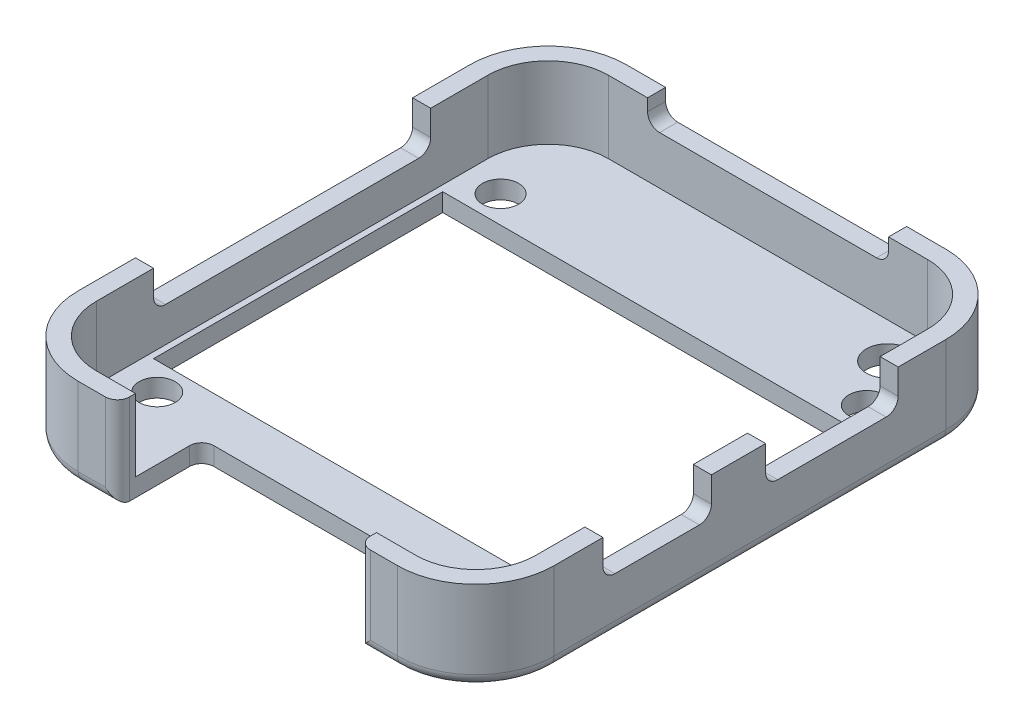
from build123d import *

# Parameters (mm, degrees)
EXTRUDE_1_DEPTH      = 1.5
EXTRUDE_2_DEPTH      = 6
EXTRUDE_2_DEPTH_BACK = 1.5
CUT_EXTRUDE_1_REACH  = 52.165
SKETCH_4_W           = 20
SKETCH_4_H           = 19.175354044
CUT_EXTRUDE_2_DEPTH  = 7
FILLET_1_R           = 1
SKETCH_5_W           = 35.5
SKETCH_5_H           = 24
CUT_EXTRUDE_3_DEPTH  = 7
SKETCH_6_R           = 1.5
CUT_EXTRUDE_4_DEPTH  = 7
CUT_EXTRUDE_5_DEPTH  = 7
CUT_EXTRUDE_6_DEPTH  = 7
SKETCH_9_R           = 1.75
CUT_EXTRUDE_7_DEPTH  = 10


with BuildPart() as part:
    # 草图1 → 凸台-拉伸1 (new body)
    with BuildSketch(Plane(origin=(0, 0, 0), x_dir=(1, 0, 0), z_dir=(0, 1, 0))):
        with BuildLine():
            Line((-13.25, 21.25), (13.25, 21.25))
            ThreePointArc((13.25, 21.25), (16.785533906, 19.785533906), (18.25, 16.25))
            Line((18.25, 16.25), (18.25, -16.25))
            ThreePointArc((18.25, -16.25), (16.785533906, -19.785533906), (13.25, -21.25))
            Line((13.25, -21.25), (-13.25, -21.25))
            ThreePointArc((-13.25, -21.25), (-16.785533906, -19.785533906), (-18.25, -16.25))
            Line((-18.25, -16.25), (-18.25, 16.25))
            ThreePointArc((-18.25, 16.25), (-16.785533906, 19.785533906), (-13.25, 21.25))
        make_face()
    extrude(amount=EXTRUDE_1_DEPTH)

    # 草图2 → 凸台-拉伸2 (add, two sides: drawn at the far end of the back side and taken through both)
    with BuildSketch(Plane(origin=(0, 1.5, 0), x_dir=(1, 0, 0), z_dir=(0, 1, 0)).offset(-EXTRUDE_2_DEPTH_BACK)):
        with BuildLine():
            Line((-13.25, -22.75), (13.25, -22.75))
            ThreePointArc((13.25, -22.75), (17.846194078, -20.846194078), (19.75, -16.25))
            Line((19.75, -16.25), (19.75, 16.25))
            ThreePointArc((19.75, 16.25), (17.846194078, 20.846194078), (13.25, 22.75))
            Line((13.25, 22.75), (-13.25, 22.75))
            ThreePointArc((-13.25, 22.75), (-17.846194078, 20.846194078), (-19.75, 16.25))
            Line((-19.75, 16.25), (-19.75, -16.25))
            ThreePointArc((-19.75, -16.25), (-17.846194078, -20.846194078), (-13.25, -22.75))
        make_face()
        with BuildLine():
            Line((-13.25, -21.25), (13.25, -21.25))
            ThreePointArc((13.25, -21.25), (16.785533906, -19.785533906), (18.25, -16.25))
            Line((18.25, -16.25), (18.25, 16.25))
            ThreePointArc((18.25, 16.25), (16.785533906, 19.785533906), (13.25, 21.25))
            Line((13.25, 21.25), (-13.25, 21.25))
            ThreePointArc((-13.25, 21.25), (-16.785533906, 19.785533906), (-18.25, 16.25))
            Line((-18.25, 16.25), (-18.25, -16.25))
            ThreePointArc((-18.25, -16.25), (-16.785533906, -19.785533906), (-13.25, -21.25))
        make_face(mode=Mode.SUBTRACT)
    extrude(amount=EXTRUDE_2_DEPTH + EXTRUDE_2_DEPTH_BACK)

    # 草图3 → 切除-拉伸1 (cut, up to next)
    with BuildSketch(Plane(origin=(0, 0, -22.75), x_dir=(-1, 0, 0), z_dir=(0, 0, -1)), mode=Mode.PRIVATE) as cut_extrude_1_sk1:
        with BuildLine():
            Line((-10, 9.5), (10, 9.5))
            Line((10, 9.5), (10, 6.5))
            ThreePointArc((10, 6.5), (9.707106781, 5.792893219), (9, 5.5))
            Line((9, 5.5), (-9, 5.5))
            ThreePointArc((-9, 5.5), (-9.707106781, 5.792893219), (-10, 6.5))
            Line((-10, 6.5), (-10, 9.5))
        make_face()
    cut_extrude_1_tool1 = extrude(cut_extrude_1_sk1.sketch, amount=-CUT_EXTRUDE_1_REACH, mode=Mode.PRIVATE) & part.part
    add(cut_extrude_1_tool1.solids().sort_by_distance((0, 7.509583, -22.75))[0], mode=Mode.SUBTRACT)

    # 草图4 → 切除-拉伸2 (cut)
    with BuildSketch(Plane.XY.offset(22.75)):
        with Locations((0, 7.5)):
            Rectangle(SKETCH_4_W, SKETCH_4_H)
    extrude(amount=-CUT_EXTRUDE_2_DEPTH, mode=Mode.SUBTRACT)

    # 圆角1
    fillet_1_edges = [part.edges().sort_by_distance(p)[0] for p in [
        (10, 0.75, 15.75),
        (-10, 0.75, 15.75),
        (-10, 3.75, 22.75),
        (10, 3.75, 22.75),
        (-17.846194078, 0, 20.846194078),
        (-19.75, 0, 0),
        (-17.846194078, 0, -20.846194078),
        (0, 0, -22.75),
        (17.846194078, 0, -20.846194078),
        (19.75, 0, 0),
        (17.846194078, 0, 20.846194078),
        (-11.625, 0, 22.75),
        (11.625, 0, 22.75),
    ]]
    fillet(fillet_1_edges, radius=FILLET_1_R)

    # 草图5 → 切除-拉伸3 (cut)
    with BuildSketch(Plane.XZ):
        Rectangle(SKETCH_5_W, SKETCH_5_H)
    extrude(amount=-CUT_EXTRUDE_3_DEPTH, mode=Mode.SUBTRACT)

    # 草图6 → 切除-拉伸4 (cut)
    with BuildSketch(Plane.XZ):
        with Locations(Location((-15.2, 14.25, 0), (0, 0, 270))):
            Circle(SKETCH_6_R)
        with Locations(Location((-15.2, -14.25, 0), (0, 0, 90))):
            Circle(SKETCH_6_R)
        with Locations(Location((15.2, -14.25, 0), (0, 0, 270))):
            Circle(SKETCH_6_R)
        with Locations(Location((15.2, 14.25, 0), (0, 0, 90))):
            Circle(SKETCH_6_R)
    extrude(amount=-CUT_EXTRUDE_4_DEPTH, mode=Mode.SUBTRACT)

    # 草图7 → 切除-拉伸5 (cut)
    with BuildSketch(Plane.ZY.offset(19.75)):
        with BuildLine():
            Line((-11.5, 10.6), (11.5, 10.6))
            Line((11.5, 10.6), (11.5, 5.4))
            ThreePointArc((11.5, 5.4), (11.207106781, 4.692893219), (10.5, 4.4))
            Line((10.5, 4.4), (-10.5, 4.4))
            ThreePointArc((-10.5, 4.4), (-11.207106781, 4.692893219), (-11.5, 5.4))
            Line((-11.5, 5.4), (-11.5, 10.6))
        make_face()
    extrude(amount=-CUT_EXTRUDE_5_DEPTH, mode=Mode.SUBTRACT)

    # 草图8 → 切除-拉伸6 (cut)
    with BuildSketch(Plane(origin=(19.75, 0, 0), x_dir=(0, 0, -1), z_dir=(1, 0, 0))):
        with BuildLine():
            Line((1.3, 10.6), (12.3, 10.6))
            Line((12.3, 10.6), (12.3, 5.4))
            ThreePointArc((12.3, 5.4), (12.007106781, 4.692893219), (11.3, 4.4))
            Line((11.3, 4.4), (2.3, 4.4))
            ThreePointArc((2.3, 4.4), (1.592893219, 4.692893219), (1.3, 5.4))
            Line((1.3, 5.4), (1.3, 10.6))
        make_face()
        with BuildLine():
            Line((-12.2, 10.6), (-3.2, 10.6))
            Line((-3.2, 10.6), (-3.2, 5.4))
            ThreePointArc((-3.2, 5.4), (-3.492893219, 4.692893219), (-4.2, 4.4))
            Line((-4.2, 4.4), (-11.2, 4.4))
            ThreePointArc((-11.2, 4.4), (-11.907106781, 4.692893219), (-12.2, 5.4))
            Line((-12.2, 5.4), (-12.2, 10.6))
        make_face()
    extrude(amount=-CUT_EXTRUDE_6_DEPTH, mode=Mode.SUBTRACT)

    # 草图9 → 切除-拉伸7 (cut)
    with BuildSketch(Plane.XZ):
        with Locations(Location((12.871040469, -18.289006858, 0), (0, 0, 270))):
            Circle(SKETCH_9_R)
    extrude(amount=-CUT_EXTRUDE_7_DEPTH, mode=Mode.SUBTRACT)


solid = part.part
